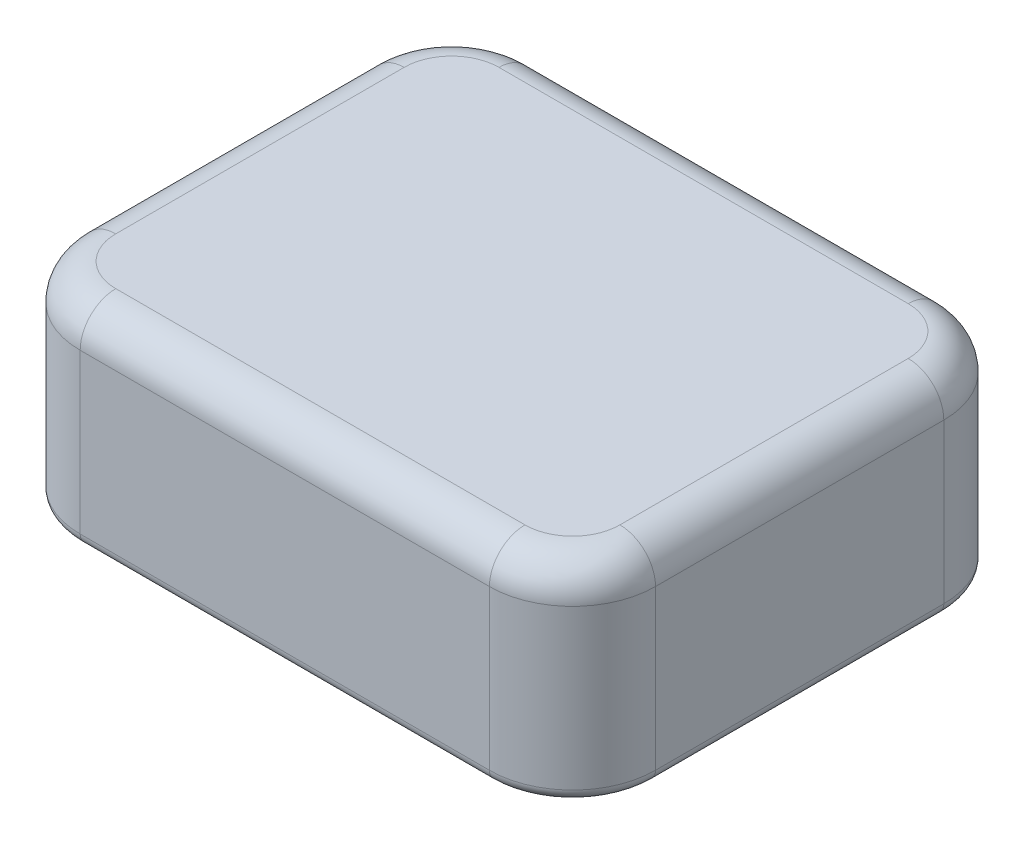
from build123d import *

# Parameters (mm, degrees)
SKETCH1_W           = 48.49
SKETCH1_H           = 38.3
BOSS_EXTRUDE1_DEPTH = 8.705
FILLET1_R           = 7
FILLET2_R           = 3
FILLET3_R           = 1


with BuildPart() as part:
    # Sketch1 → Boss-Extrude1 (new, symmetric)
    with BuildSketch(Plane(origin=(0, 0, 0), x_dir=(1, 0, 0), z_dir=(0, 1, 0))):
        Rectangle(SKETCH1_W, SKETCH1_H)
    extrude(amount=BOSS_EXTRUDE1_DEPTH, both=True)

    # Fillet1
    fillet1_edges = [part.edges().sort_by_distance(p)[0] for p in [
        (24.245, 0, 19.15),
        (-24.245, 0, 19.15),
        (-24.245, 0, -19.15),
        (24.245, 0, -19.15),
    ]]
    fillet(fillet1_edges, radius=FILLET1_R)

    # Fillet2
    fillet2_edges = [part.edges().sort_by_distance(p)[0] for p in [
        (-24.245, 8.705, 0),
        (0, 8.705, -19.15),
        (24.245, 8.705, 0),
        (0, 8.705, 19.15),
        (-22.194747468, 8.705, 17.099747468),
        (22.194747468, 8.705, 17.099747468),
        (22.194747468, 8.705, -17.099747468),
        (-22.194747468, 8.705, -17.099747468),
    ]]
    fillet(fillet2_edges, radius=FILLET2_R)

    # Fillet3
    fillet3_edges = [part.edges().sort_by_distance(p)[0] for p in [
        (-24.245, -8.705, 0),
        (24.245, -8.705, 0),
        (0, -8.705, 19.15),
        (0, -8.705, -19.15),
        (-22.194747468, -8.705, 17.099747468),
        (22.194747468, -8.705, 17.099747468),
        (22.194747468, -8.705, -17.099747468),
        (-22.194747468, -8.705, -17.099747468),
    ]]
    fillet(fillet3_edges, radius=FILLET3_R)


solid = part.part
